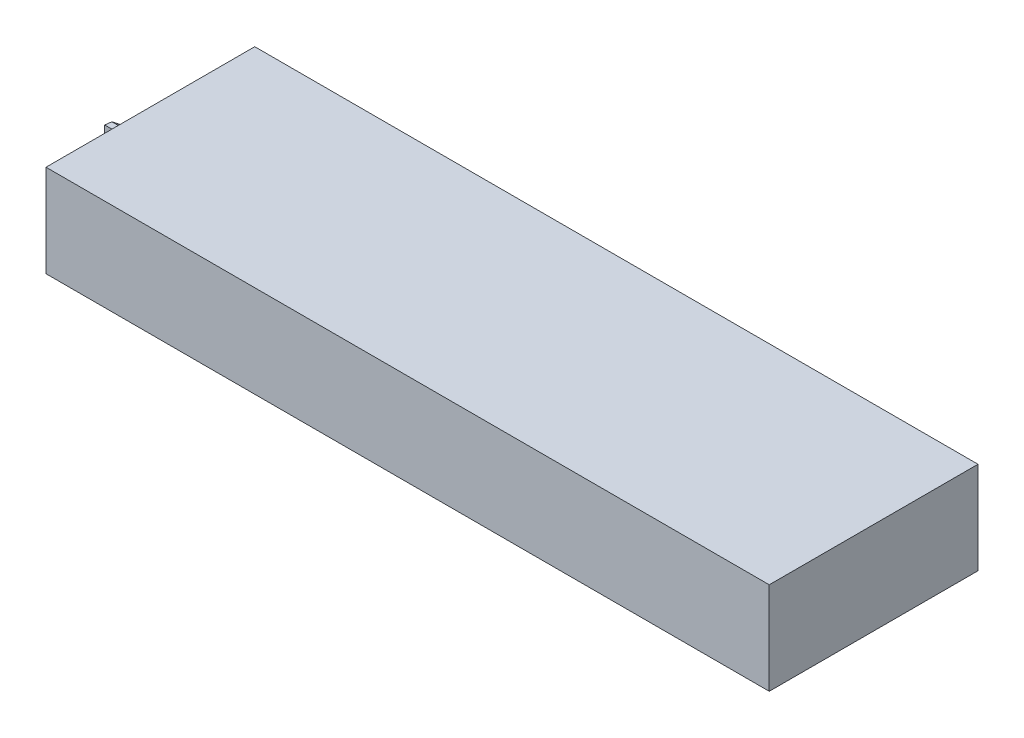
from build123d import *

# Parameters (mm, degrees)
CROQUIS1_W                   = 22
CROQUIS1_H                   = 6.35
SALIENTE_EXTRUIR1_DEPTH      = 2.8067
SALIENTE_EXTRUIR2_REACH      = 24.404
SALIENTE_EXTRUIR2_END_RADIUS = 3.9624
CORTAR_EXTRUIR1_DEPTH        = 23.404423445


with BuildPart() as part:
    # Croquis1 → Saliente-Extruir1 (new body)
    with BuildSketch(Plane(origin=(0, 0, 0), x_dir=(1, 0, 0), z_dir=(0, 1, 0))):
        Rectangle(CROQUIS1_W, CROQUIS1_H)
    extrude(amount=SALIENTE_EXTRUIR1_DEPTH)

    # Saliente-Extruir2: up to this cylinder (the profile starts outside it)
    saliente_extruir2_end = Plane(origin=(-15.73075, 1.120248, 0), z_dir=(0, -1, 0)) * Cylinder(SALIENTE_EXTRUIR2_END_RADIUS, 57.7328, mode=Mode.PRIVATE)
    # Croquis2 → Saliente-Extruir2 (add, up to the surface)
    with BuildSketch(Plane.ZY.offset(11), mode=Mode.PRIVATE) as saliente_extruir2_sk1:
        Polygon((1.35, 1.152803077), (0.692307692, 1.152803077), (0.692307692, 2.329726154), (0.346153846, 2.329726154), (-1.315384615, 1.048956923), (-1.315384615, 0.806649231), (0.346153846, 0.806649231), (0.346153846, 0.460495385), (0.692307692, 0.460495385), (0.692307692, 0.806649231), (1.35, 0.806649231), align=None)
        Polygon((0.346153846, 1.152803077), (-0.626322115, 1.152803077), (0.346153846, 1.9024425), align=None, mode=Mode.SUBTRACT)
    saliente_extruir2_tool1 = extrude(saliente_extruir2_sk1.sketch, amount=SALIENTE_EXTRUIR2_REACH, mode=Mode.PRIVATE) - saliente_extruir2_end
    add(saliente_extruir2_tool1.solids().sort_by_distance((-11, 1.120248, 1.021154))[0])

    # Croquis5 → Cortar-Extruir1 (cut, through all)
    # profile 1 of 2: a face of its own
    with BuildSketch(Plane.ZY.offset(11)):
        Polygon((1.35, 1.152803077), (1.35, 0.806649231), (0.692307692, 0.806649231), (0.692307692, 0.460495385), (0.346153846, 0.460495385), (0.346153846, 0.806649231), (-1.315384615, 0.806649231), (-1.315384615, 1.048956923), (0.346153846, 2.329726154), (0.692307692, 2.329726154), (0.692307692, 1.152803077), align=None)
        Polygon((0.578007692, 0.920949231), (1.2357, 0.920949231), (1.2357, 1.038503077), (0.578007692, 1.038503077), (0.578007692, 2.215426154), (0.385093942, 2.215426154), (-1.201084615, 0.992746849), (-1.201084615, 0.920949231), (0.460453846, 0.920949231), (0.460453846, 0.574795385), (0.578007692, 0.574795385), align=None, mode=Mode.SUBTRACT)
    # profile 2 of 2: a face of its own
    with BuildSketch(Plane.ZY.offset(11)):
        Polygon((0.460453846, 2.13486934), (-0.961816385, 1.038503077), (0.460453846, 1.038503077), align=None)
        Polygon((0.346153846, 1.9024425), (-0.626322115, 1.152803077), (0.346153846, 1.152803077), align=None, mode=Mode.SUBTRACT)
    extrude(amount=CORTAR_EXTRUIR1_DEPTH, mode=Mode.SUBTRACT)


solid = part.part
